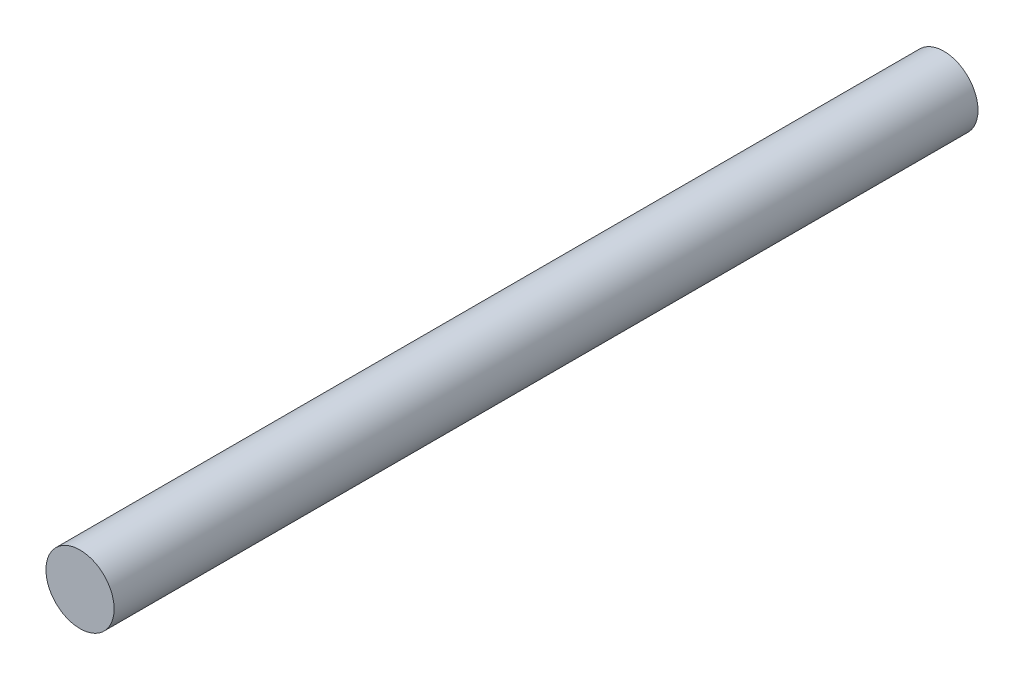
from build123d import *

# Parameters (mm, degrees)
SKETCH_1_R      = 1.5
EXTRUDE_1_DEPTH = 38


with BuildPart() as part:
    # 草图1 → 凸台-拉伸1 (new body)
    with BuildSketch(Plane.XY):
        Circle(SKETCH_1_R)
    extrude(amount=EXTRUDE_1_DEPTH)


solid = part.part
